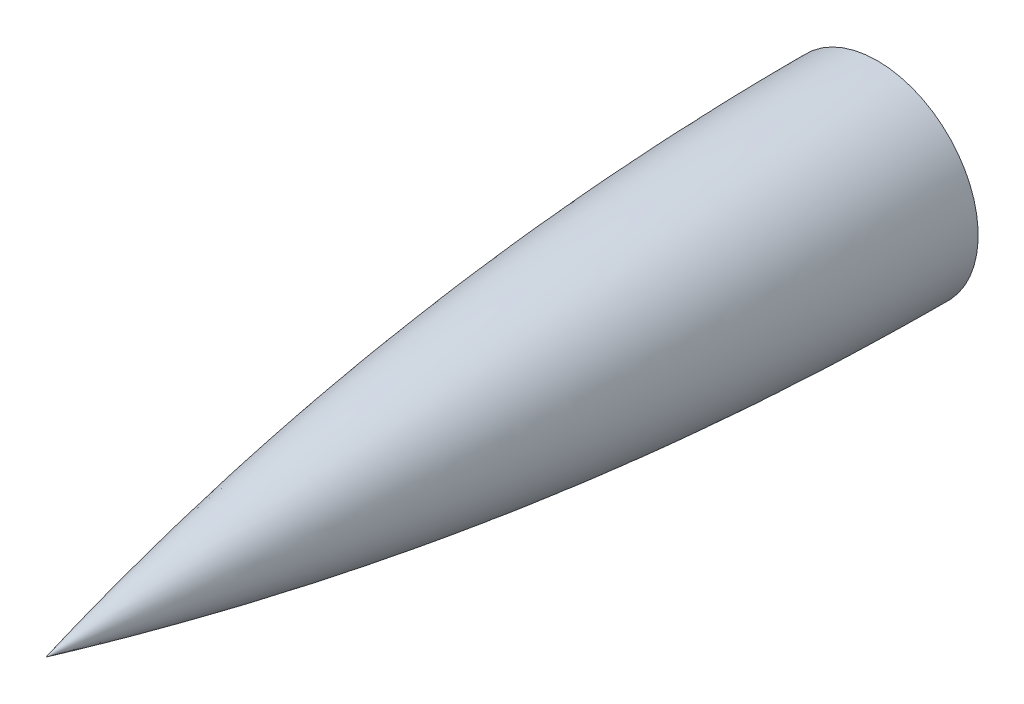
from build123d import *


with BuildPart() as part:
    # Sketch1 → Revolve1 (revolve)
    with BuildSketch(Plane(origin=(0, 0, 0), x_dir=(0, 0, -1), z_dir=(1, 0, 0))):
        with BuildLine():
            Line((0, 50.8), (0, 0))
            Line((0, 0), (-419.1, 0))
            add(Edge.make_bspline(
                [(-419.1, 0), (-418.516049996, 0.143674558), (-417.341057947, 0.431955686), (-415.267914976, 0.938981599), (-413.113503119, 1.462344761), (-411.037356499, 1.964012902), (-408.262170449, 2.631372107), (-404.378328377, 3.557888028), (-400.173762608, 4.548318185), (-395.922569003, 5.53772293), (-391.651205531, 6.5216717), (-387.341006827, 7.504502498), (-382.312547992, 8.636255059), (-375.121587963, 10.229408995), (-366.48497628, 12.102283793), (-357.837358665, 13.926941684), (-349.180103041, 15.703057499), (-341.958976598, 17.150878539), (-336.178329207, 18.289698787), (-330.393813965, 19.409115585), (-324.605615588, 20.509086915), (-317.365763284, 21.859748913), (-305.772427953, 23.96891213), (-269.492204423, 30.276012579), (-211.179717997, 38.806420934), (-152.540374476, 44.850500822), (-95.196715508, 48.433623126), (-62.815978494, 49.693715998), (-52.510587206, 50.025435385), (-43.676007236, 50.260314021), (-37.785784938, 50.397117105), (-32.631483434, 50.499508613), (-28.213260077, 50.574906803), (-24.547186576, 50.629258964), (-21.633332153, 50.667600044), (-18.734938706, 50.700935343), (-15.85317443, 50.729352106), (-12.973618493, 50.753032858), (-10.072664337, 50.771977537), (-7.235225246, 50.786186091), (-4.373407354, 50.795658482), (-1.811066829, 50.799210633), (-0.60136508, 50.8), (0, 50.8)],
                knots=[0.08280964, 0.08280964, 0.08280964, 0.08280964, 0.08280964, 0.088493714, 0.094177787, 0.097019824, 0.09986186, 0.105545934, 0.11691408, 0.128282227, 0.134091531, 0.139900835, 0.151519444, 0.163138052, 0.174756661, 0.197993873, 0.221231086, 0.232849694, 0.244468301, 0.256086909, 0.267705517, 0.279324125, 0.290942732, 0.314179948, 0.360654377, 0.569789307, 0.755687024, 0.778924238, 0.813780061, 0.825398668, 0.837017275, 0.848635883, 0.86025449, 0.866063794, 0.871873097, 0.877557171, 0.883241244, 0.888925317, 0.89460939, 0.900293463, 0.905977536, 0.911661609, 0.917345683, 0.917345683, 0.917345683, 0.917345683, 0.917345683], degree=4))
        make_face()
    revolve(axis=Axis((0, 0, 0), (0, 0, 1)))


solid = part.part
